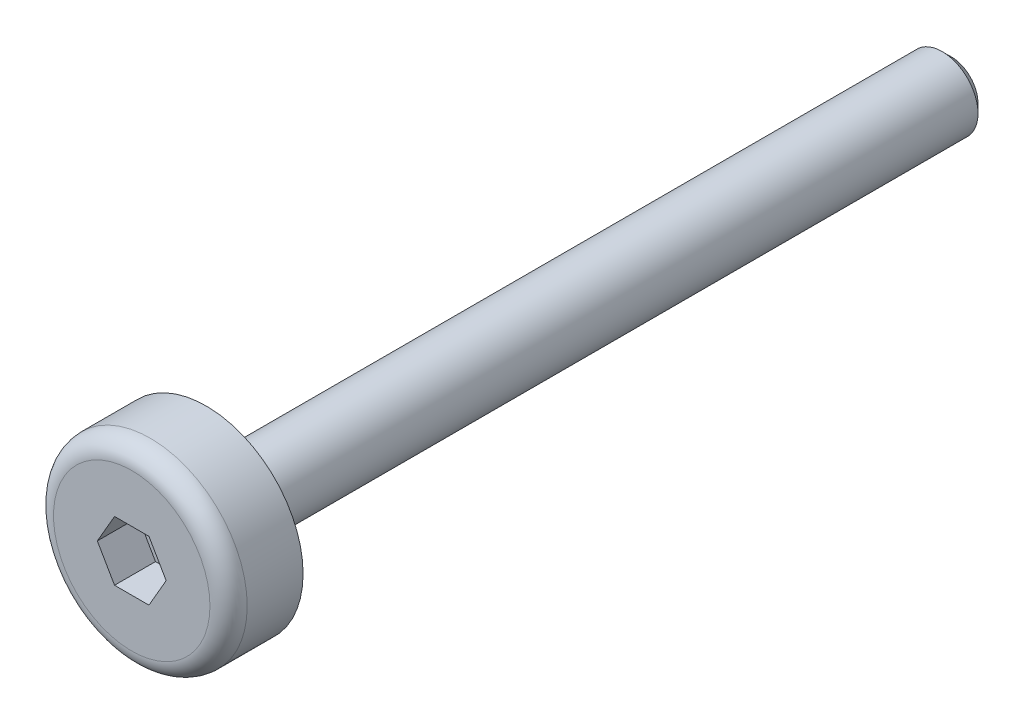
from build123d import *

# Parameters (mm, degrees)
SHANK_TIP_CHAMFER_SIZE = 0.3
PAN_HEAD_ROUND_R       = 0.625
HEX_DRIVE_CUT_DEPTH    = 1.375


with BuildPart() as part:
    # Screw Section → Screw Blank Revolve (revolve)
    with BuildSketch(Plane(origin=(0, 0, 0), x_dir=(1, 0, 0), z_dir=(0, 1, 0))):
        Polygon((0, 25), (1.2, 25), (1.2, 0), (3.25, 0), (3.25, -2.5), (0, -2.5), align=None)
    revolve(axis=Axis((0, 0, 10.123), (0, 0, -1)))

    # Shank Tip Chamfer
    shank_tip_chamfer_edges = [part.edges().sort_by_distance(p)[0] for p in [
        (-1.2, 0, -25),
    ]]
    chamfer(shank_tip_chamfer_edges, length=SHANK_TIP_CHAMFER_SIZE)

    # Pan Head Round
    pan_head_round_edges = [part.edges().sort_by_distance(p)[0] for p in [
        (-3.25, 0, 2.5),
    ]]
    fillet(pan_head_round_edges, radius=PAN_HEAD_ROUND_R)

    # Hex Drive Sketch → Hex Drive Cut (cut)
    with BuildSketch(Plane.XY.offset(2.5)):
        Polygon((1.154700538, 0), (0.577350269, 1), (-0.577350269, 1), (-1.154700538, 0), (-0.577350269, -1), (0.577350269, -1), align=None)
    extrude(amount=-HEX_DRIVE_CUT_DEPTH, mode=Mode.SUBTRACT)


solid = part.part
